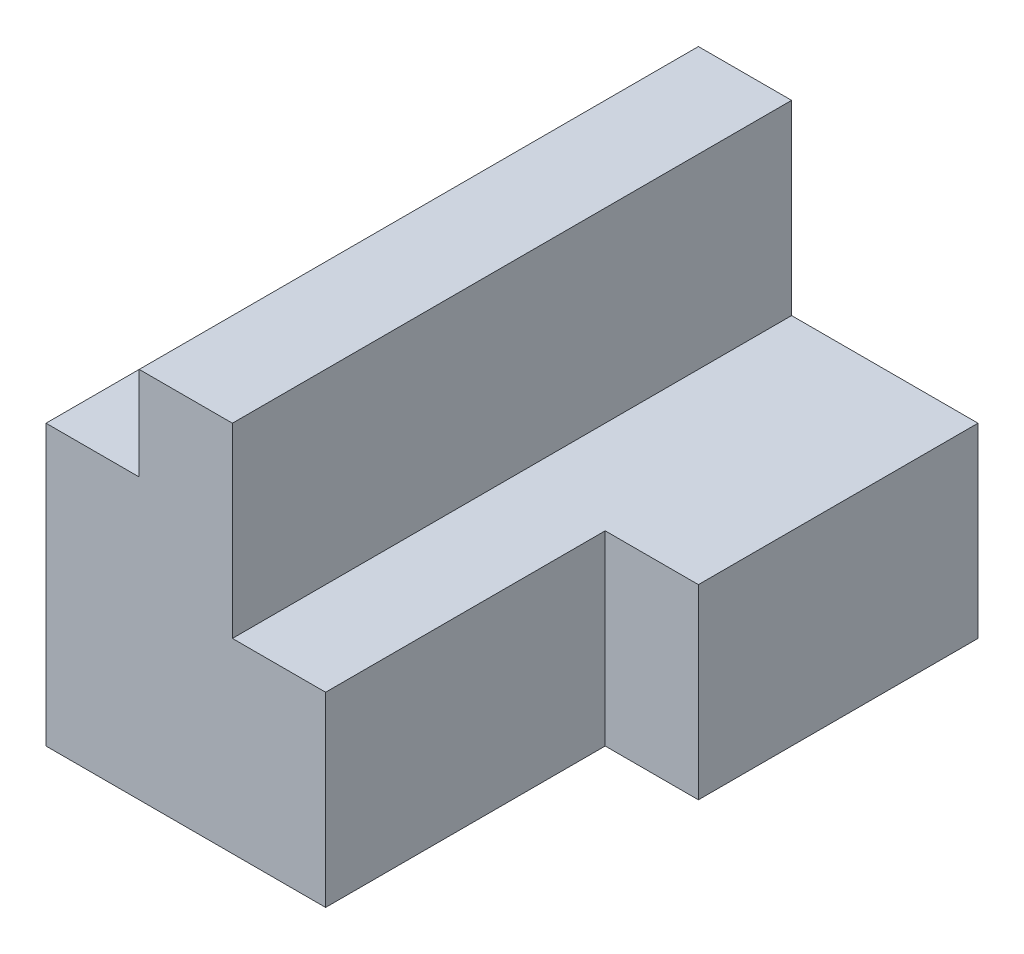
from build123d import *

# Parameters (mm, degrees)
SKETCH1_W           = 40
SKETCH1_H           = 40
BOSS_EXTRUDE1_DEPTH = 60
SKETCH2_W           = 20
SKETCH2_H           = 60
CUT_EXTRUDE1_DEPTH  = 20
SKETCH3_W           = 10
SKETCH3_H           = 30
CUT_EXTRUDE2_DEPTH  = 20
SKETCH4_W           = 10
SKETCH4_H           = 60
CUT_EXTRUDE3_DEPTH  = 10


with BuildPart() as part:
    # Sketch1 → Boss-Extrude1 (new body)
    with BuildSketch(Plane.XY):
        with Locations((20, 20)):
            Rectangle(SKETCH1_W, SKETCH1_H)
    extrude(amount=BOSS_EXTRUDE1_DEPTH)

    # Sketch2 → Cut-Extrude1 (cut)
    with BuildSketch(Plane(origin=(0, 40, 0), x_dir=(1, 0, 0), z_dir=(0, 1, 0))):
        with Locations((30, -30)):
            Rectangle(SKETCH2_W, SKETCH2_H)
    extrude(amount=-CUT_EXTRUDE1_DEPTH, mode=Mode.SUBTRACT)

    # Sketch3 → Cut-Extrude2 (cut)
    with BuildSketch(Plane(origin=(0, 20, 0), x_dir=(1, 0, 0), z_dir=(0, 1, 0))):
        with Locations((35, -45)):
            Rectangle(SKETCH3_W, SKETCH3_H)
    extrude(amount=-CUT_EXTRUDE2_DEPTH, mode=Mode.SUBTRACT)

    # Sketch4 → Cut-Extrude3 (cut)
    with BuildSketch(Plane(origin=(0, 40, 0), x_dir=(1, 0, 0), z_dir=(0, 1, 0))):
        with Locations((5, -30)):
            Rectangle(SKETCH4_W, SKETCH4_H)
    extrude(amount=-CUT_EXTRUDE3_DEPTH, mode=Mode.SUBTRACT)


solid = part.part
